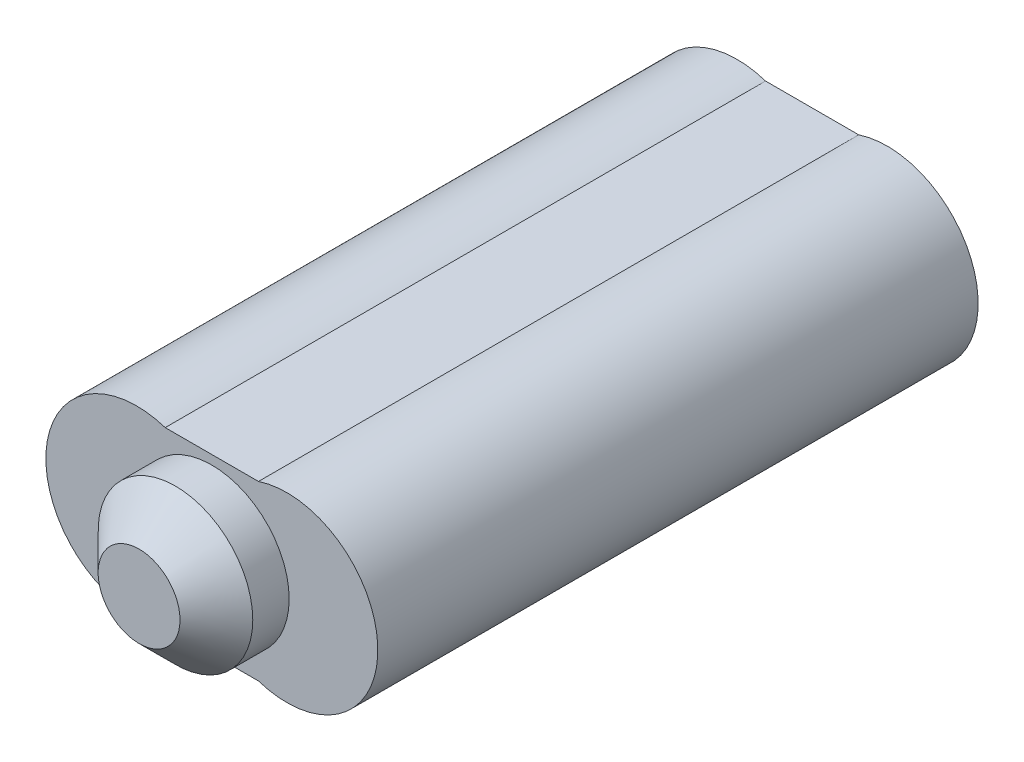
from build123d import *

# Parameters (mm, degrees)
BOSS_EXTRUDE1_DEPTH = 66
SKETCH2_R           = 8.5
BOSS_EXTRUDE2_DEPTH = 8
CHAMFER1_SIZE       = 4


with BuildPart() as part:
    # Sketch1 → Boss-Extrude1 (new body)
    with BuildSketch(Plane.XY):
        with BuildLine():
            Line((3.122498999, 9.5), (13.377501001, 9.5))
            ThreePointArc((13.377501001, 9.5), (26.5, 0), (13.377501001, -9.5))
            Line((13.377501001, -9.5), (3.122498999, -9.5))
            ThreePointArc((3.122498999, -9.5), (-10, 0), (3.122498999, 9.5))
        make_face()
    extrude(amount=BOSS_EXTRUDE1_DEPTH)

    # Sketch2 → Boss-Extrude2 (add)
    with BuildSketch(Plane.XY.offset(66)):
        with Locations((8.25, 0)):
            Circle(SKETCH2_R)
    extrude(amount=BOSS_EXTRUDE2_DEPTH)

    # Chamfer1
    chamfer1_edges = [part.edges().sort_by_distance(p)[0] for p in [
        (-0.25, 0, 74),
    ]]
    chamfer(chamfer1_edges, length=CHAMFER1_SIZE)


solid = part.part
